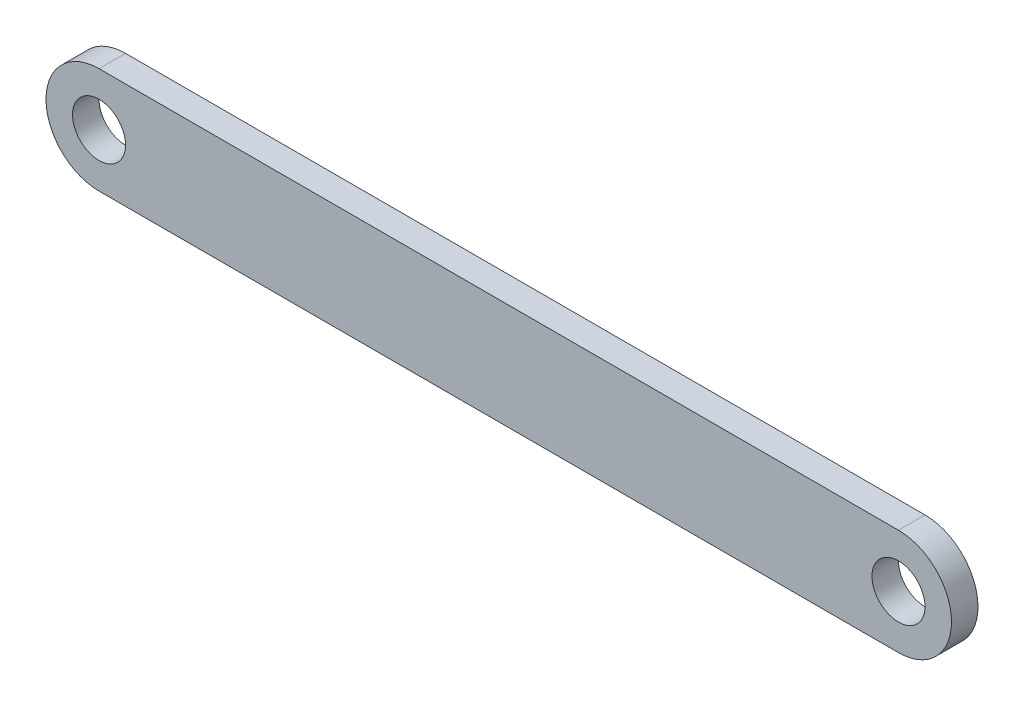
from build123d import *

# Parameters (mm, degrees)
SKETCH_1_R      = 1
EXTRUDE_1_DEPTH = 0.5


with BuildPart() as part:
    # Эскиз1 → Бобышка-Вытянуть1 (new, symmetric)
    with BuildSketch(Plane.XY):
        with BuildLine():
            Line((0, 2), (-30.1536, 2))
            ThreePointArc((-30.1536, 2), (-32.1536, 0), (-30.1536, -2))
            Line((-30.1536, -2), (0, -2))
            ThreePointArc((0, -2), (2, 0), (0, 2))
        make_face()
        with Locations((-30.1536, 0)):
            Circle(SKETCH_1_R, mode=Mode.SUBTRACT)
        Circle(SKETCH_1_R, mode=Mode.SUBTRACT)
    extrude(amount=EXTRUDE_1_DEPTH, both=True)


solid = part.part
